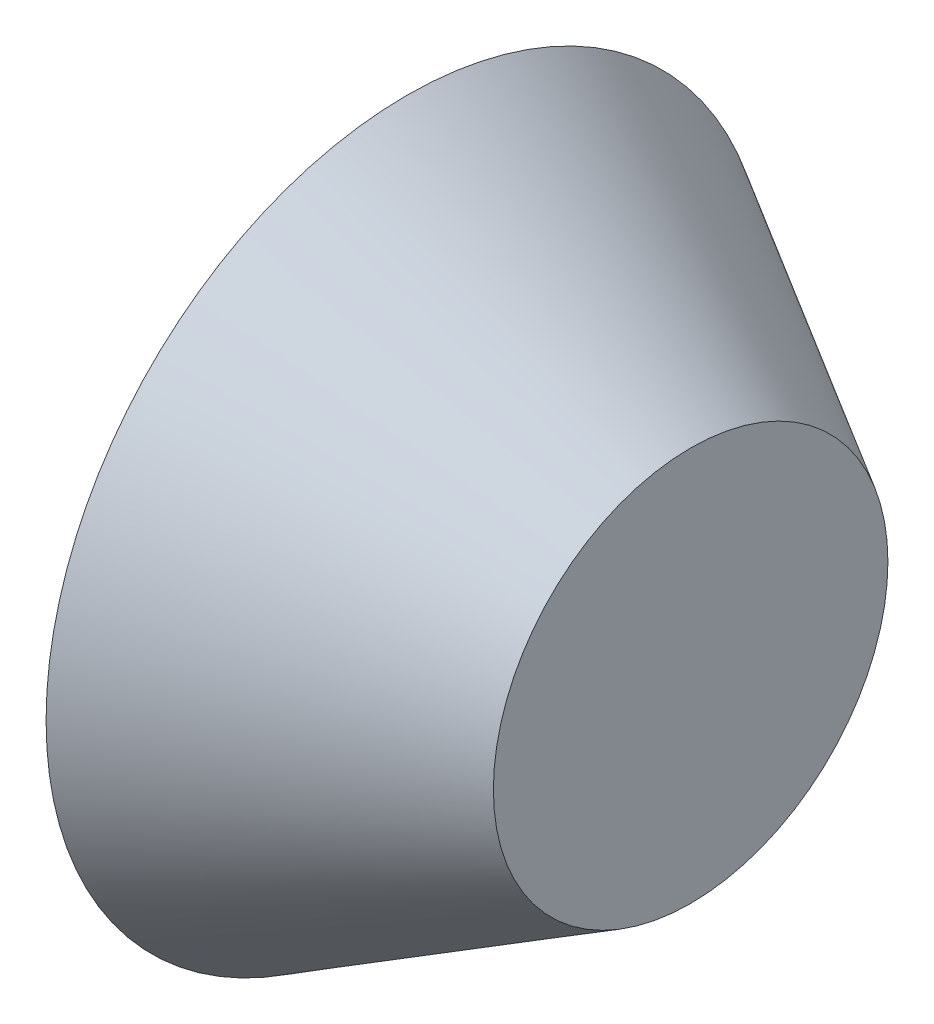
from build123d import *


with BuildPart() as part:
    # 草图1 → 旋转1 (revolve)
    with BuildSketch(Plane.XY, mode=Mode.PRIVATE) as revolve_1_sk:
        Polygon((0.110433477, 14.639528096), (11.610433477, 8), (11.610433477, 0), (8.610433477, 0), (8.610433477, 6.267949192), (0.110433477, 11.175426481), align=None)
    revolve(revolve_1_sk.sketch.rotate(Axis((-17.092465753, 0, 0), (1, 0, 0)), 90), axis=Axis((-17.092465753, 0, 0), (1, 0, 0)))


solid = part.part
